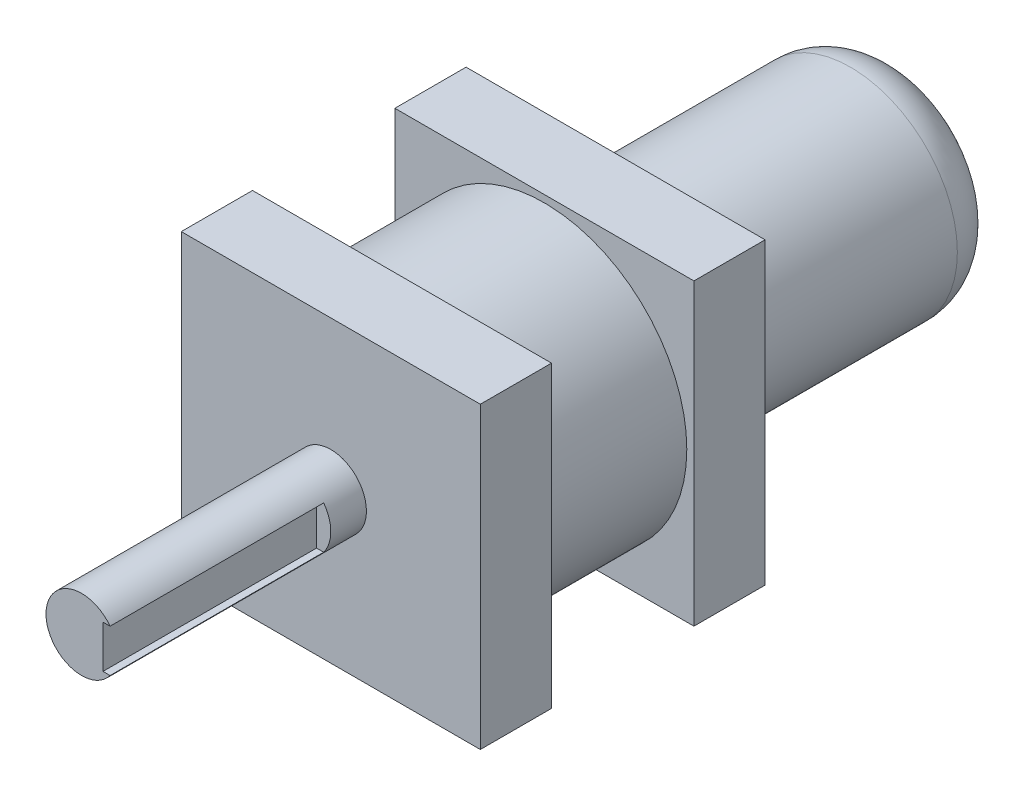
from build123d import *

# Parameters (mm, degrees)
SKETCH1_R           = 15
BOSS_EXTRUDE1_DEPTH = 40
SKETCH2_W           = 42
SKETCH2_H           = 42
BOSS_EXTRUDE4_DEPTH = 10
SKETCH3_R           = 20
BOSS_EXTRUDE5_DEPTH = 20
SKETCH4_W           = 42
SKETCH4_H           = 42
BOSS_EXTRUDE6_DEPTH = 10
SKETCH5_R           = 5
BOSS_EXTRUDE7_DEPTH = 35
FILLET3_R           = 7
SKETCH6_R           = 1.25
BOSS_EXTRUDE8_DEPTH = 5
FILLET5_R           = 0.3
SKETCH7_W           = 4
SKETCH7_H           = 6
CUT_EXTRUDE1_DEPTH  = 30


with BuildPart() as part:
    # Sketch1 → Boss-Extrude1 (new body)
    with BuildSketch(Plane.XY):
        Circle(SKETCH1_R)
    extrude(amount=BOSS_EXTRUDE1_DEPTH)

    # Sketch2 → Boss-Extrude4 (add)
    with BuildSketch(Plane.XY.offset(40)):
        Rectangle(SKETCH2_W, SKETCH2_H)
    extrude(amount=BOSS_EXTRUDE4_DEPTH)

    # Sketch3 → Boss-Extrude5 (add)
    with BuildSketch(Plane.XY.offset(50)):
        Circle(SKETCH3_R)
    extrude(amount=BOSS_EXTRUDE5_DEPTH)

    # Sketch4 → Boss-Extrude6 (add)
    with BuildSketch(Plane.XY.offset(70)):
        Rectangle(SKETCH4_W, SKETCH4_H)
    extrude(amount=BOSS_EXTRUDE6_DEPTH)

    # Sketch5 → Boss-Extrude7 (add)
    with BuildSketch(Plane.XY.offset(80)):
        Circle(SKETCH5_R)
    extrude(amount=BOSS_EXTRUDE7_DEPTH)

    # Fillet3
    fillet3_edges = [part.edges().sort_by_distance(p)[0] for p in [
        (-15, 0, 0),
    ]]
    fillet(fillet3_edges, radius=FILLET3_R)

    # Sketch6 → Boss-Extrude8 (add)
    with BuildSketch(Plane(origin=(0, 0, 0), x_dir=(-1, 0, 0), z_dir=(0, 0, -1))):
        with Locations(Location((0, 0, 0), (0, 0, 180))):
            Circle(SKETCH6_R)
    extrude(amount=BOSS_EXTRUDE8_DEPTH)

    # Fillet5
    fillet5_edges = [part.edges().sort_by_distance(p)[0] for p in [
        (-1.25, 0, -5),
    ]]
    fillet(fillet5_edges, radius=FILLET5_R)

    # Sketch7 → Cut-Extrude1 (cut)
    with BuildSketch(Plane.XY.offset(115)):
        with Locations((5, 0)):
            Rectangle(SKETCH7_W, SKETCH7_H)
    extrude(amount=-CUT_EXTRUDE1_DEPTH, mode=Mode.SUBTRACT)


solid = part.part
